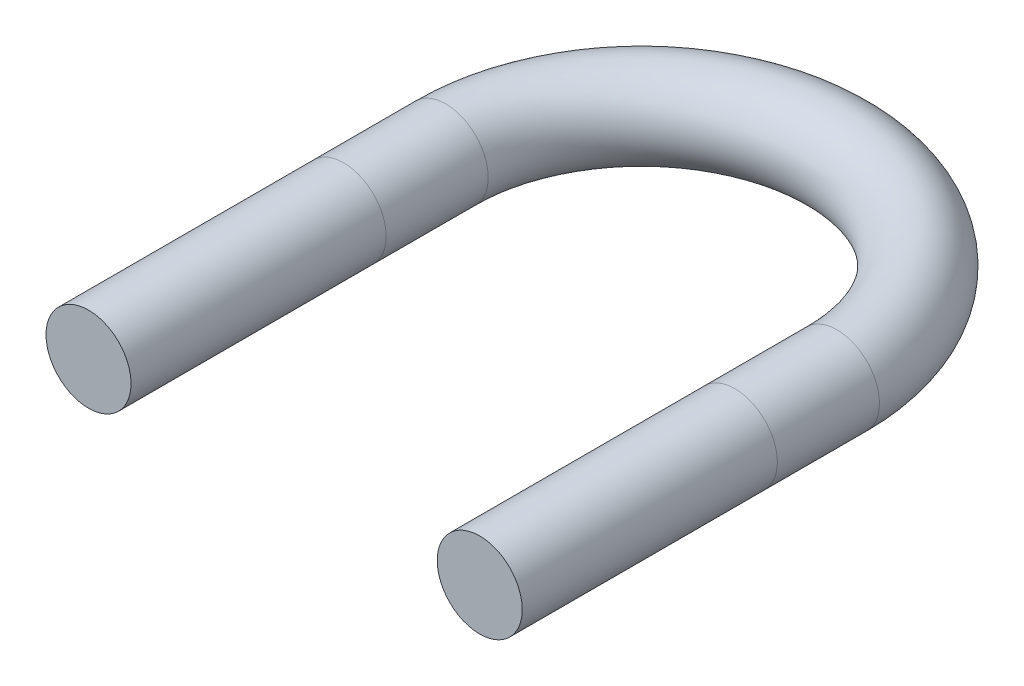
from build123d import *

# Parameters (mm, degrees)
SWEEP1_PROFILE_R = 5


with BuildPart() as part:
    # Sweep1: sweep along a path in Sketch1
    with BuildLine(Plane(origin=(0, 0, 0), x_dir=(1, 0, 0), z_dir=(0, 1, 0))) as sweep1_path:
        Line((-23, -42), (-23, 0))
        ThreePointArc((-23, 0), (0, 23), (23, 0))
        Line((23, 0), (23, -42))
    # Sweep1 profile (on start of the path) → Sweep1 (sweep)
    with BuildSketch(Plane(origin=(-23, 0, 42), x_dir=(-1, 0, 0), z_dir=(0, 0, -1))):
        Circle(SWEEP1_PROFILE_R)
    sweep(path=sweep1_path.line)


solid = part.part
